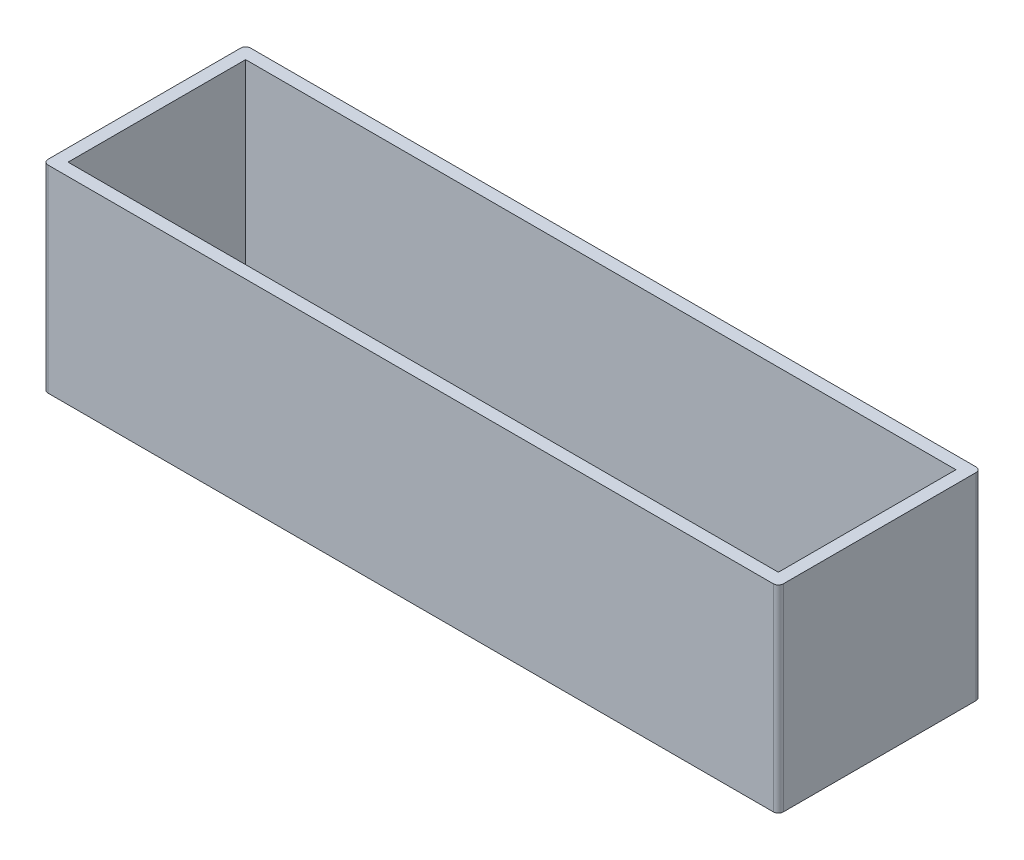
from build123d import *
from OCP.BRepFilletAPI import BRepFilletAPI_MakeChamfer

# Parameters (mm, degrees)
SKETCH1_W           = 294
SKETCH1_H           = 81
SKETCH1_W_2         = 284
SKETCH1_H_2         = 71
BOSS_EXTRUDE1_DEPTH = 79
FILLET1_R           = 2
CHAMFER1_SIZE       = 2
CHAMFER1_SIZE2      = 3.464101615


with BuildPart() as part:
    # Sketch1 → Boss-Extrude1 (new body)
    with BuildSketch(Plane(origin=(0, 0, 0), x_dir=(1, 0, 0), z_dir=(0, 1, 0))):
        Rectangle(SKETCH1_W, SKETCH1_H)
        Rectangle(SKETCH1_W_2, SKETCH1_H_2, mode=Mode.SUBTRACT)
    extrude(amount=BOSS_EXTRUDE1_DEPTH)

    # Fillet1
    fillet1_edges = [part.edges().sort_by_distance(p)[0] for p in [
        (-147, 39.5, -40.5),
        (147, 39.5, -40.5),
        (147, 39.5, 40.5),
        (-147, 39.5, 40.5),
    ]]
    fillet(fillet1_edges, radius=FILLET1_R)

    # Chamfer1: one chamfer whose edges measure the first distance from different faces: ONE call of the kernel's chamfer builder (chamfer() names one face for all edges)
    chamfer1_edges_1 = [part.edges().sort_by_distance(p)[0] for p in [
        (-142, 0, 0),
    ]]
    chamfer1_side_1 = [part.faces().sort_by_distance(p)[0] for p in [
        (-142, 39.5, 0),
    ]]
    chamfer1_edges_2 = [part.edges().sort_by_distance(p)[0] for p in [
        (0, 0, 35.5),
    ]]
    chamfer1_side_2 = [part.faces().sort_by_distance(p)[0] for p in [
        (0, 39.5, 35.5),
    ]]
    chamfer1_edges_3 = [part.edges().sort_by_distance(p)[0] for p in [
        (142, 0, 0),
    ]]
    chamfer1_side_3 = [part.faces().sort_by_distance(p)[0] for p in [
        (142, 39.5, 0),
    ]]
    chamfer1_edges_4 = [part.edges().sort_by_distance(p)[0] for p in [
        (0, 0, -35.5),
    ]]
    chamfer1_side_4 = [part.faces().sort_by_distance(p)[0] for p in [
        (0, 39.5, -35.5),
    ]]
    chamfer1 = BRepFilletAPI_MakeChamfer(part.part.solid().wrapped)
    for e in chamfer1_edges_1:
        chamfer1.Add(CHAMFER1_SIZE, CHAMFER1_SIZE2, e.wrapped, chamfer1_side_1[0].wrapped)  # the first distance lies on this face
    for e in chamfer1_edges_2:
        chamfer1.Add(CHAMFER1_SIZE, CHAMFER1_SIZE2, e.wrapped, chamfer1_side_2[0].wrapped)  # the first distance lies on this face
    for e in chamfer1_edges_3:
        chamfer1.Add(CHAMFER1_SIZE, CHAMFER1_SIZE2, e.wrapped, chamfer1_side_3[0].wrapped)  # the first distance lies on this face
    for e in chamfer1_edges_4:
        chamfer1.Add(CHAMFER1_SIZE, CHAMFER1_SIZE2, e.wrapped, chamfer1_side_4[0].wrapped)  # the first distance lies on this face
    add(Compound.cast(chamfer1.Shape()), mode=Mode.REPLACE)


solid = part.part
